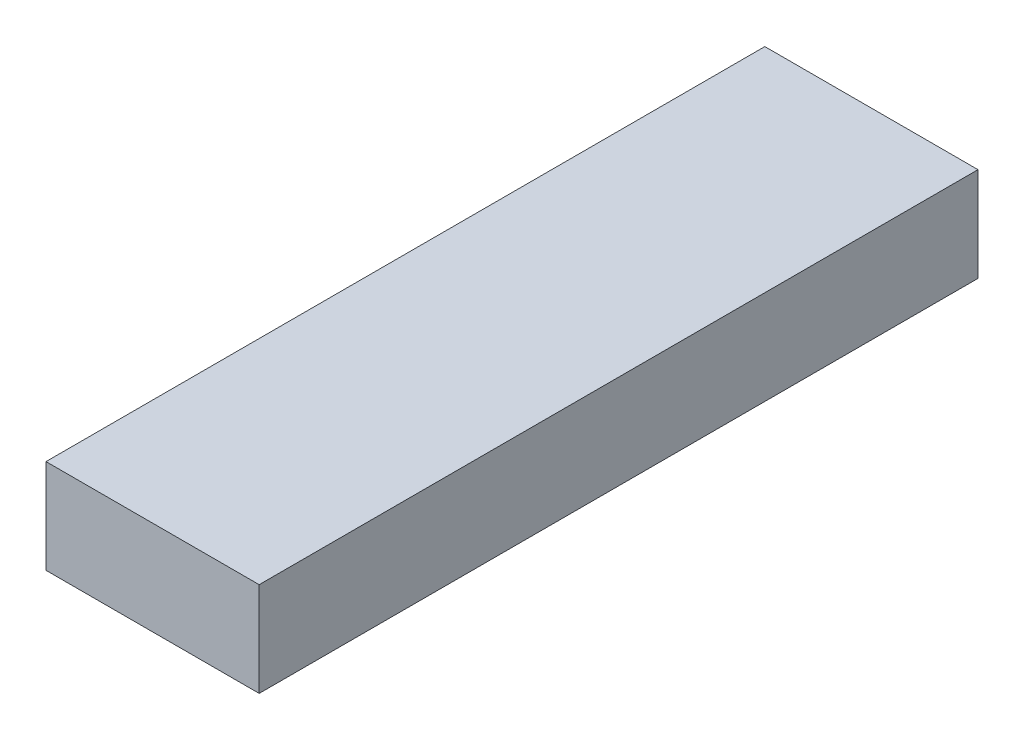
from build123d import *

# Parameters (mm, degrees)
ESQUISSE1_W        = 43
ESQUISSE1_H        = 145
BOSS_EXTRU_1_DEPTH = 19


with BuildPart() as part:
    # Esquisse1 → Boss.-Extru.1 (new body)
    with BuildSketch(Plane(origin=(0, 0, 0), x_dir=(1, 0, 0), z_dir=(0, 1, 0))):
        Rectangle(ESQUISSE1_W, ESQUISSE1_H)
    extrude(amount=BOSS_EXTRU_1_DEPTH)


solid = part.part
